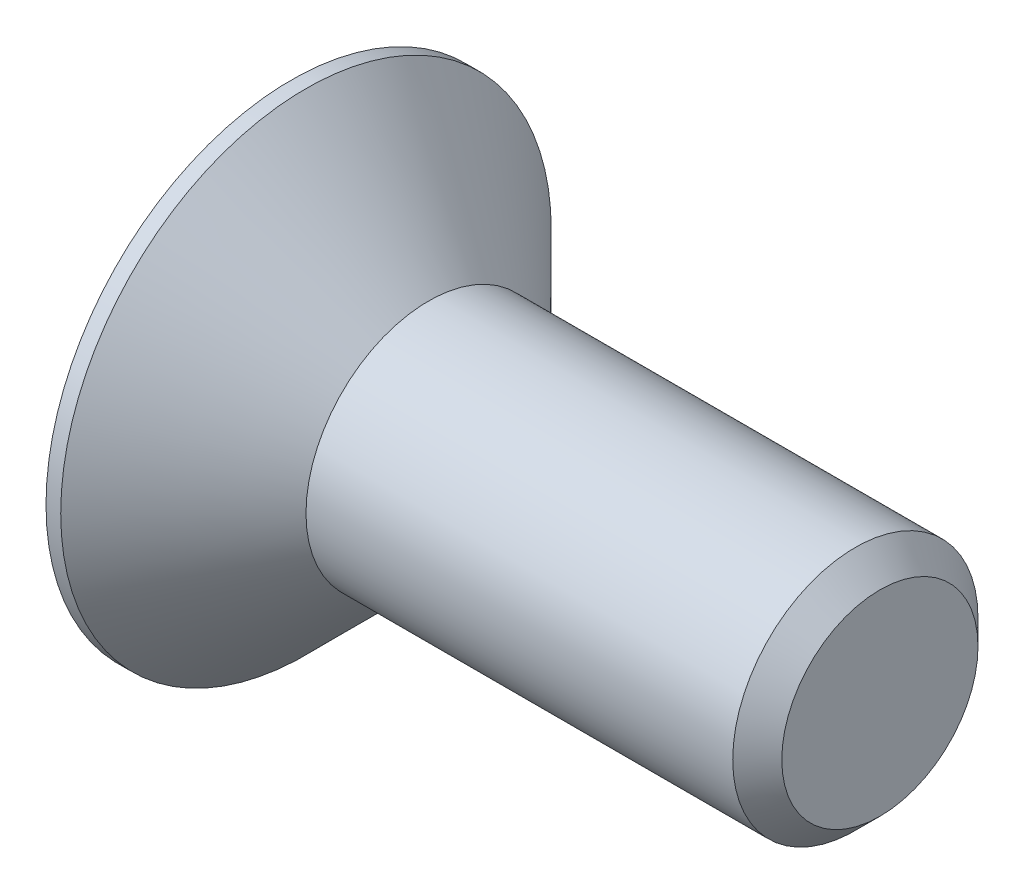
from build123d import *

# Parameters (mm, degrees)
CUT_EXTRUDE1_DEPTH = 0.8


with BuildPart() as part:
    # Sketch2 → Revolve1 (revolve)
    with BuildSketch(Plane.XY, mode=Mode.PRIVATE) as revolve1_sk:
        Polygon((0, 0), (0, 2.5), (0.15, 2.5), (1.4, 1.25), (5.75, 1.25), (6, 1), (6, 0), align=None)
    revolve(revolve1_sk.sketch.rotate(Axis((-2.281841559, 0, 0), (1, 0, 0)), 90), axis=Axis((-2.281841559, 0, 0), (1, 0, 0)))

    # Sketch3 → Cut-Extrude1 (cut)
    with BuildSketch(Plane.ZY):
        Polygon((0.433012702, -0.75), (0.866025404, 0), (0.433012702, 0.75), (-0.433012702, 0.75), (-0.866025404, 0), (-0.433012702, -0.75), align=None)
    extrude(amount=-CUT_EXTRUDE1_DEPTH, mode=Mode.SUBTRACT)


solid = part.part
